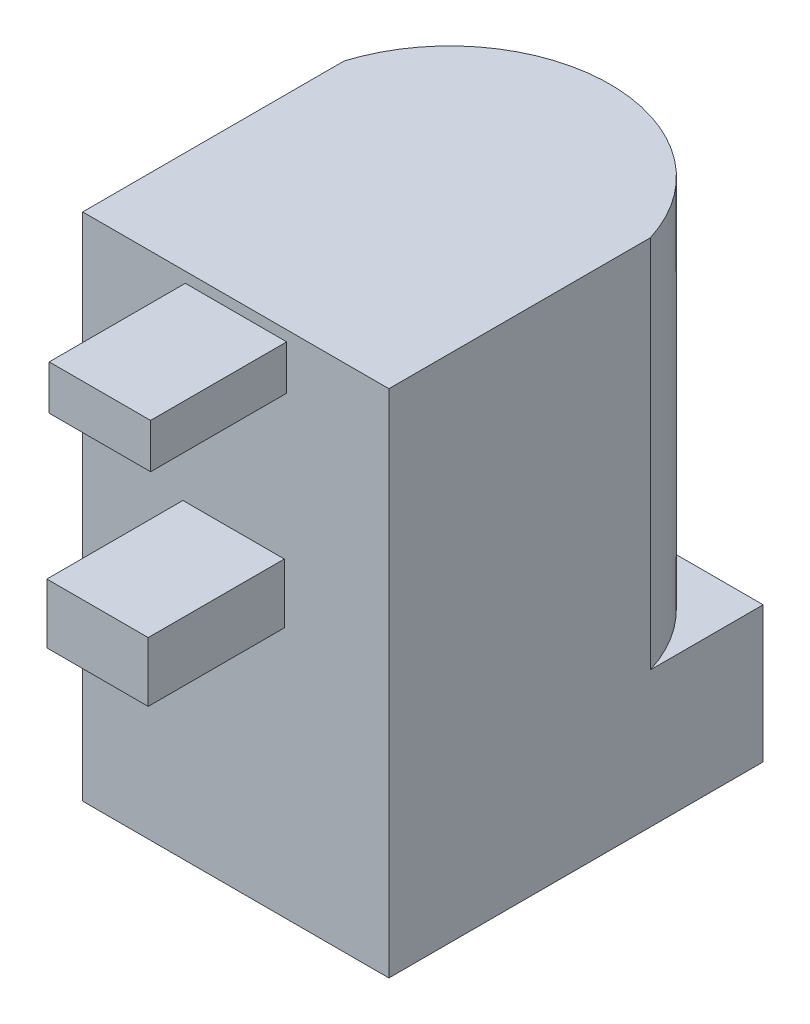
from build123d import *

# Parameters (mm, degrees)
SKETCH1_W           = 9
SKETCH1_H           = 11
BOSS_EXTRUDE1_DEPTH = 15
CUT_EXTRUDE1_DEPTH  = 11
SKETCH3_R           = 3.15
CUT_EXTRUDE2_DEPTH  = 11
SKETCH4_W           = 2.979879399
SKETCH4_H           = 1.306685084
SKETCH4_W_2         = 2.979879398
SKETCH4_H_2         = 1.752870235
BOSS_EXTRUDE2_DEPTH = 4


with BuildPart() as part:
    # Sketch1 → Boss-Extrude1 (new body)
    with BuildSketch(Plane(origin=(0, 0, 0), x_dir=(1, 0, 0), z_dir=(0, 1, 0))):
        with Locations((0.651810585, 0.165738162)):
            Rectangle(SKETCH1_W, SKETCH1_H)
    extrude(amount=BOSS_EXTRUDE1_DEPTH)

    # Sketch2 → Cut-Extrude1 (cut)
    with BuildSketch(Plane(origin=(0, 15, 0), x_dir=(1, 0, 0), z_dir=(0, 1, 0))):
        with BuildLine():
            Line((-3.848189415, 2.350983054), (-6.541968857, 7.081862959))
            Line((-6.541968857, 7.081862959), (7.054694978, 6.829449645))
            Line((7.054694978, 6.829449645), (5.151810585, 2.350983054))
            ThreePointArc((5.151810585, 2.350983054), (0.651810585, 5.665738162), (-3.848189415, 2.350983054))
        make_face()
    extrude(amount=-CUT_EXTRUDE1_DEPTH, mode=Mode.SUBTRACT)

    # Sketch3 → Cut-Extrude2 (cut)
    with BuildSketch(Plane.XZ):
        with Locations(Location((0.651810585, -0.165738162, 0), (0, 0, 270))):
            Circle(SKETCH3_R)
    extrude(amount=-CUT_EXTRUDE2_DEPTH, mode=Mode.SUBTRACT)

    # Sketch4 → Boss-Extrude2 (add)
    with BuildSketch(Plane.XY.offset(5.334261838)):
        with Locations((0.657536683, 14.037179674)):
            Rectangle(SKETCH4_W, SKETCH4_H)
        with Locations((0.588068697, 8.251967659)):
            Rectangle(SKETCH4_W_2, SKETCH4_H_2)
    extrude(amount=BOSS_EXTRUDE2_DEPTH)


solid = part.part
